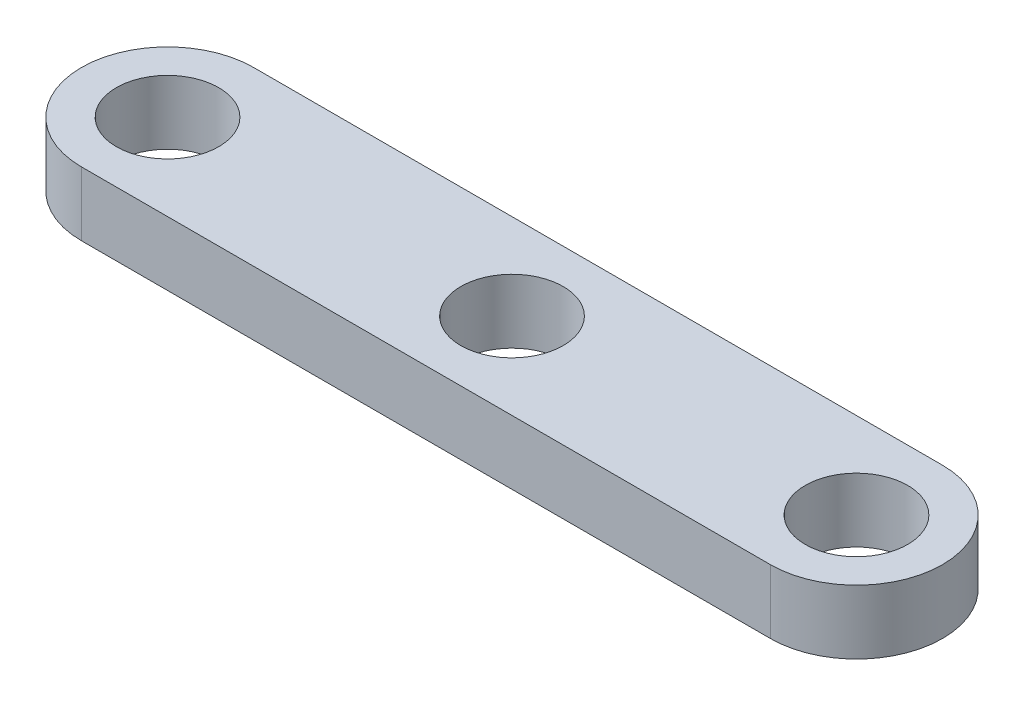
from build123d import *

# Parameters (mm, degrees)
SKETCH1_R           = 2.4
BOSS_EXTRUDE2_DEPTH = 3


with BuildPart() as part:
    # Sketch1 → Boss-Extrude2 (new body)
    with BuildSketch(Plane(origin=(0, 0, 0), x_dir=(1, 0, 0), z_dir=(0, 1, 0))):
        with BuildLine():
            Line((16.145, 4.035), (-16.145, 4.035))
            ThreePointArc((-16.145, 4.035), (-18.99817587, 2.853175854), (-20.18, -2.2e-08))
            ThreePointArc((-20.18, -2.2e-08), (-18.998175854, -2.85317587), (-16.145, -4.035))
            Line((-16.145, -4.035), (16.145, -4.035))
            ThreePointArc((16.145, -4.035), (18.998175862, -2.853175862), (20.18, 0))
            ThreePointArc((20.18, 0), (18.998175862, 2.853175862), (16.145, 4.035))
        make_face()
        with Locations(Location((-16.145, 0, 0), (0, 0, 270))):
            Circle(SKETCH1_R, mode=Mode.SUBTRACT)
        with Locations(Location((0, 0, 0), (0, 0, 270))):
            Circle(SKETCH1_R, mode=Mode.SUBTRACT)
        with Locations(Location((16.145, 0, 0), (0, 0, 270))):
            Circle(SKETCH1_R, mode=Mode.SUBTRACT)
    extrude(amount=BOSS_EXTRUDE2_DEPTH)


solid = part.part
